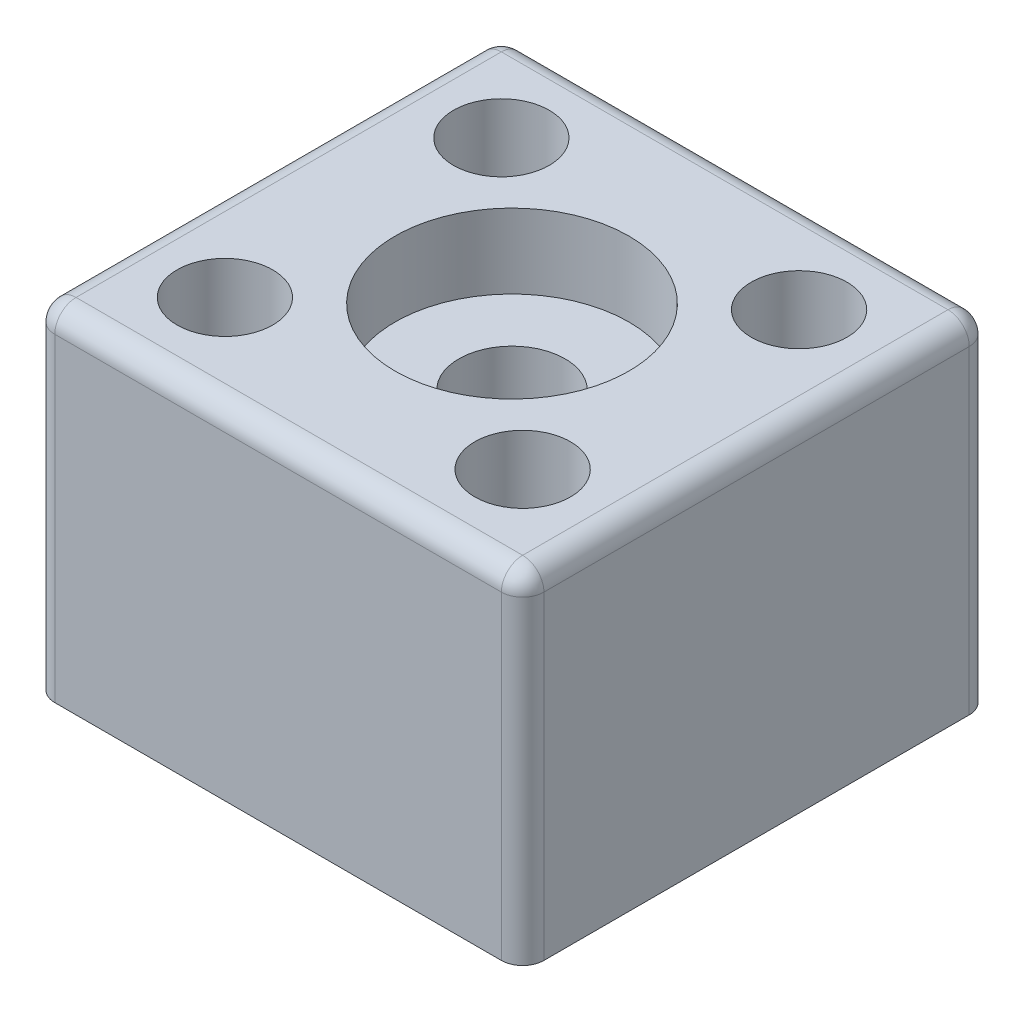
from build123d import *

# Parameters (mm, degrees)
SKETCH1_W            = 46
SKETCH1_H            = 44
BOSS_EXTRUDE1_DEPTH  = 32
SKETCH2_R            = 2.65
CUT_EXTRUDE1_DEPTH   = 46.133136386
LPATTERN1_COUNT      = 2
LPATTERN1_PITCH      = 26
LPATTERN1_COUNT_DIR2 = 2
LPATTERN1_PITCH_DIR2 = 28
SKETCH3_R            = 11
CUT_EXTRUDE2_DEPTH   = 7
FILLET1_R            = 2
SKETCH4_R            = 4.5
CUT_EXTRUDE3_DEPTH   = 22
LPATTERN2_COUNT      = 2
LPATTERN2_PITCH      = 28
LPATTERN2_COUNT_DIR2 = 2
LPATTERN2_PITCH_DIR2 = 26
SKETCH5_R            = 5
CUT_EXTRUDE4_DEPTH   = 46.133136386


with BuildPart() as part:
    # Sketch1 → Boss-Extrude1 (new body)
    with BuildSketch(Plane(origin=(0, 0, 0), x_dir=(1, 0, 0), z_dir=(0, 1, 0))):
        Rectangle(SKETCH1_W, SKETCH1_H)
    extrude(amount=BOSS_EXTRUDE1_DEPTH)

    # Sketch2 → Cut-Extrude1 (cut, through all)
    with BuildSketch(Plane.XZ):
        with Locations(Location((-14, -13, 0), (0, 0, 270))):
            Circle(SKETCH2_R)
    cut_extrude1 = extrude(amount=-CUT_EXTRUDE1_DEPTH, mode=Mode.SUBTRACT)

    # LPattern1: Cut-Extrude1 2 × 2
    with Locations(*[(j * LPATTERN1_PITCH_DIR2, 0, i * LPATTERN1_PITCH) for i in range(LPATTERN1_COUNT) for j in range(LPATTERN1_COUNT_DIR2) if (i, j) != (0, 0)]):
        add(cut_extrude1, mode=Mode.SUBTRACT)

    # Sketch3 → Cut-Extrude2 (cut)
    with BuildSketch(Plane(origin=(0, 32, 0), x_dir=(1, 0, 0), z_dir=(0, 1, 0))):
        with Locations(Location((0, 0, 0), (0, 0, 270))):
            Circle(SKETCH3_R)
    extrude(amount=-CUT_EXTRUDE2_DEPTH, mode=Mode.SUBTRACT)

    # Fillet1
    fillet1_edges = [part.edges().sort_by_distance(p)[0] for p in [
        (-23, 32, 0),
        (0, 32, 22),
        (23, 32, 0),
        (23, 16, 22),
        (-23, 16, 22),
        (-23, 16, -22),
        (23, 16, -22),
        (0, 32, -22),
    ]]
    fillet(fillet1_edges, radius=FILLET1_R)

    # Sketch4 → Cut-Extrude3 (cut)
    with BuildSketch(Plane(origin=(0, 32, 0), x_dir=(1, 0, 0), z_dir=(0, 1, 0))):
        with Locations(Location((14, -13, 0), (0, 0, 270))):
            Circle(SKETCH4_R)
    cut_extrude3 = extrude(amount=-CUT_EXTRUDE3_DEPTH, mode=Mode.SUBTRACT)

    # LPattern2: Cut-Extrude3 2 × 2
    with Locations(*[(-i * LPATTERN2_PITCH, 0, -j * LPATTERN2_PITCH_DIR2) for i in range(LPATTERN2_COUNT) for j in range(LPATTERN2_COUNT_DIR2) if (i, j) != (0, 0)]):
        add(cut_extrude3, mode=Mode.SUBTRACT)

    # Sketch5 → Cut-Extrude4 (cut, through all)
    with BuildSketch(Plane(origin=(0, 32, 0), x_dir=(1, 0, 0), z_dir=(0, 1, 0))):
        with Locations(Location((0, 0, 0), (0, 0, 270))):
            Circle(SKETCH5_R)
    extrude(amount=-CUT_EXTRUDE4_DEPTH, mode=Mode.SUBTRACT)


solid = part.part
